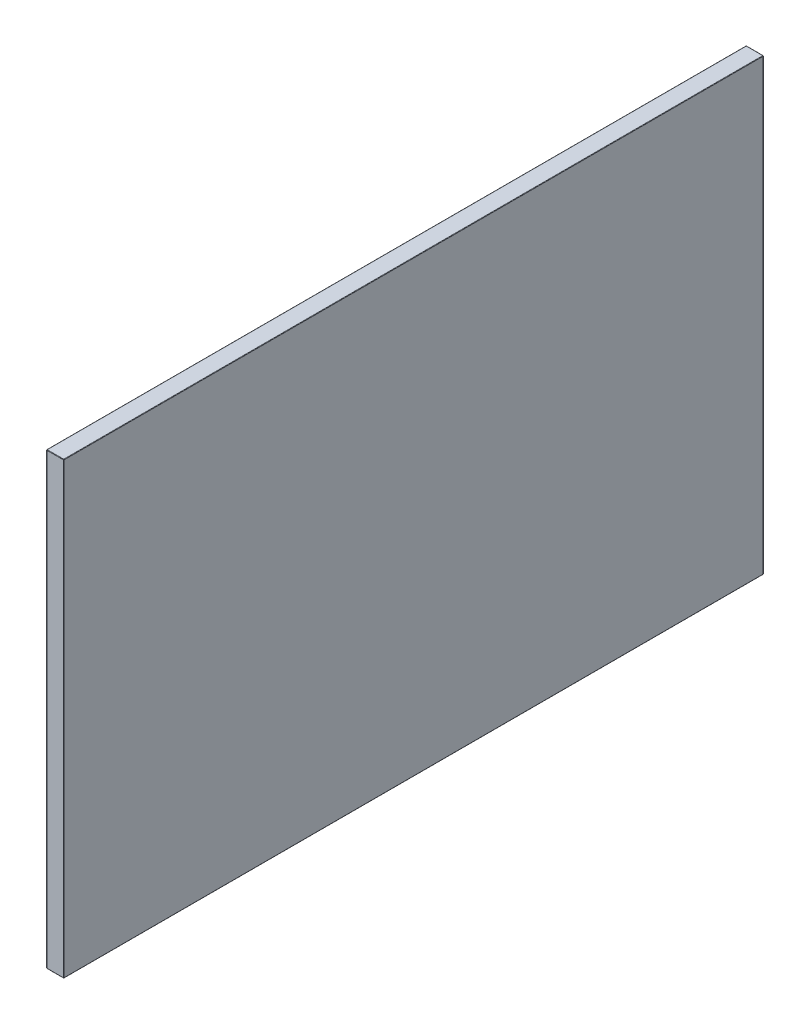
from build123d import *

# Parameters (mm, degrees)
SKETCH1_W           = 810
SKETCH1_H           = 520
BOSS_EXTRUDE1_DEPTH = 20
FILLET1_R           = 0.5


with BuildPart() as part:
    # Sketch1 → Boss-Extrude1 (new body)
    with BuildSketch(Plane(origin=(0, 0, 0), x_dir=(0, 0, -1), z_dir=(1, 0, 0))):
        Rectangle(SKETCH1_W, SKETCH1_H)
    extrude(amount=BOSS_EXTRUDE1_DEPTH)

    # Fillet1
    fillet1_edges = [part.edges().sort_by_distance(p)[0] for p in [
        (20, -260, 0),
        (20, 0, 405),
        (20, 260, 0),
        (0, 0, 405),
        (0, -260, 0),
        (0, 0, -405),
        (0, 260, 0),
        (10, 260, 405),
        (10, -260, 405),
        (10, -260, -405),
        (10, 260, -405),
        (20, 0, -405),
    ]]
    fillet(fillet1_edges, radius=FILLET1_R)


solid = part.part
